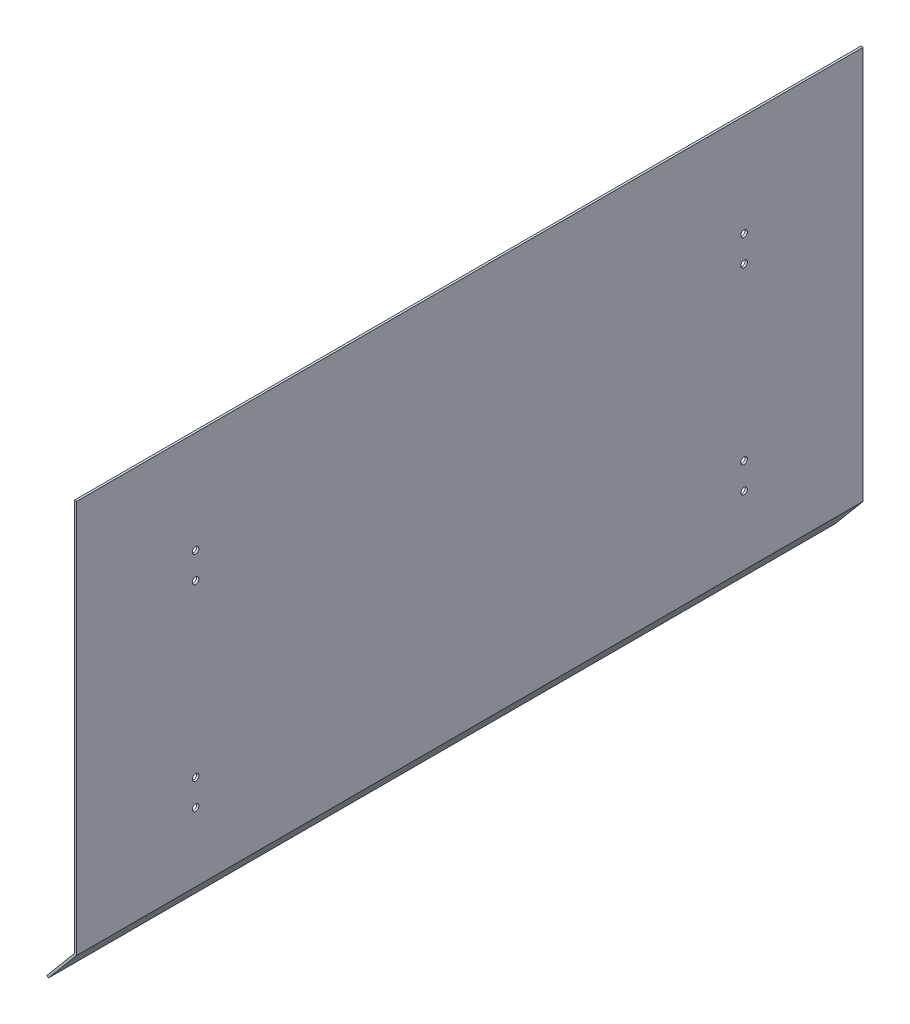
from build123d import *

# Parameters (mm, degrees)
EXTRUDE_1_DEPTH     = 360
SKETCH_2_R          = 1.5
CUT_EXTRUDE_1_DEPTH = 380


with BuildPart() as part:
    # 草图1 → 凸台-拉伸1 (new body)
    with BuildSketch(Plane.XY):
        Polygon((0, 0), (0, 180), (-1, 180), (-1, 0.363970234), (-13.621796637, -14.678101253), (-12.855752194, -15.320888862), align=None)
    extrude(amount=EXTRUDE_1_DEPTH)

    # 草图2 → 切除-拉伸1 (cut)
    with BuildSketch(Plane.ZY.offset(1)):
        with Locations((305.5, 31.363970234)):
            Circle(SKETCH_2_R)
        with Locations((305.5, 43.363970234)):
            Circle(SKETCH_2_R)
        with Locations((305.5, 121.363970234)):
            Circle(SKETCH_2_R)
        with Locations((305.5, 133.363970234)):
            Circle(SKETCH_2_R)
        with Locations((54.5, 121.363970234)):
            Circle(SKETCH_2_R)
        with Locations((54.5, 31.363970234)):
            Circle(SKETCH_2_R)
        with Locations((54.5, 43.363970234)):
            Circle(SKETCH_2_R)
        with Locations((54.5, 133.363970234)):
            Circle(SKETCH_2_R)
    extrude(amount=-CUT_EXTRUDE_1_DEPTH, mode=Mode.SUBTRACT)


solid = part.part
